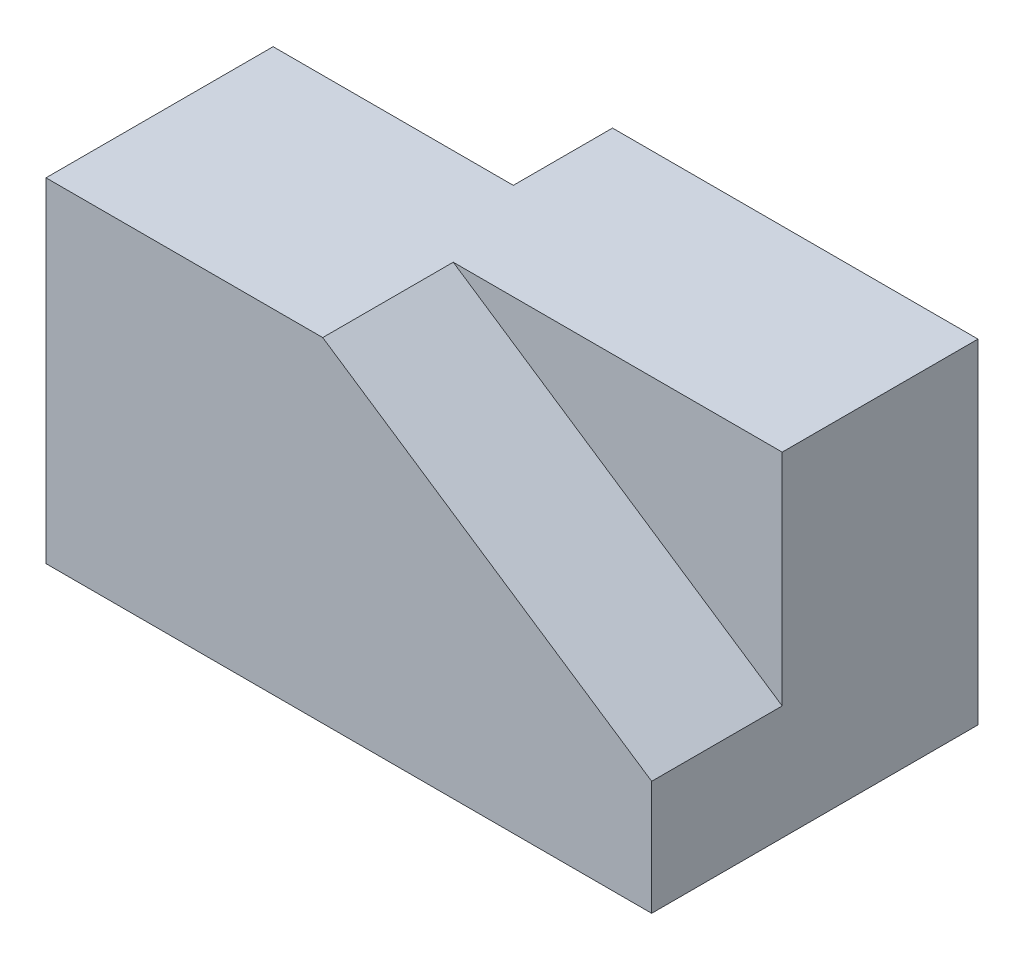
from build123d import *

# Parameters (mm, degrees)
SKETCH1_W           = 58.928
SKETCH1_H           = 31.75
BOSS_EXTRUDE1_DEPTH = 32.512
CUT_EXTRUDE1_DEPTH  = 12.7
SKETCH4_W           = 23.368
SKETCH4_H           = 9.652
CUT_EXTRUDE2_DEPTH  = 11.176


with BuildPart() as part:
    # Sketch1 → Boss-Extrude1 (new body)
    with BuildSketch(Plane(origin=(0, 0, 0), x_dir=(1, 0, 0), z_dir=(0, 1, 0))):
        with Locations((29.464, 15.875)):
            Rectangle(SKETCH1_W, SKETCH1_H)
    extrude(amount=BOSS_EXTRUDE1_DEPTH)

    # Sketch3 → Cut-Extrude1 (cut)
    with BuildSketch(Plane.XY):
        Polygon((26.924, 32.512), (58.928, 11.1252), (58.928, 32.512), align=None)
    extrude(amount=-CUT_EXTRUDE1_DEPTH, mode=Mode.SUBTRACT)

    # Sketch4 → Cut-Extrude2 (cut)
    with BuildSketch(Plane(origin=(0, 32.512, 0), x_dir=(1, 0, 0), z_dir=(0, 1, 0))):
        with Locations((11.684, 26.924)):
            Rectangle(SKETCH4_W, SKETCH4_H)
    extrude(amount=-CUT_EXTRUDE2_DEPTH, mode=Mode.SUBTRACT)


solid = part.part
